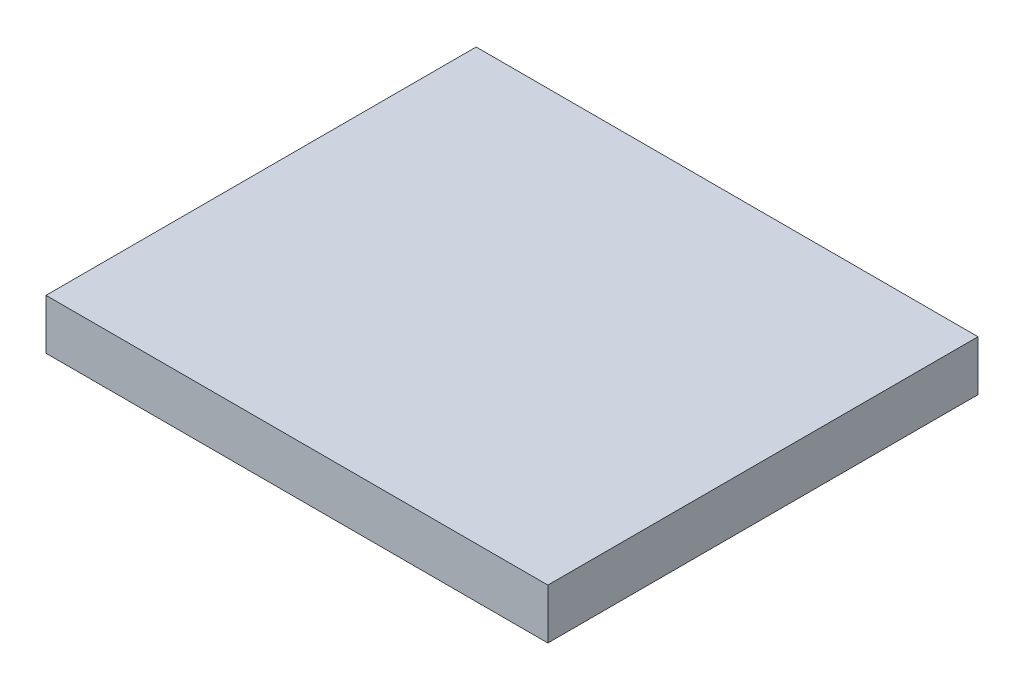
from build123d import *

# Parameters (mm, degrees)
SKETCH_1_W      = 35
SKETCH_1_H      = 30
EXTRUDE_1_DEPTH = 3.5


with BuildPart() as part:
    # 스케치1 → 보스-돌출1 (new body)
    with BuildSketch(Plane(origin=(0, 0, 0), x_dir=(1, 0, 0), z_dir=(0, 1, 0))):
        Rectangle(SKETCH_1_W, SKETCH_1_H)
    extrude(amount=EXTRUDE_1_DEPTH)


solid = part.part
